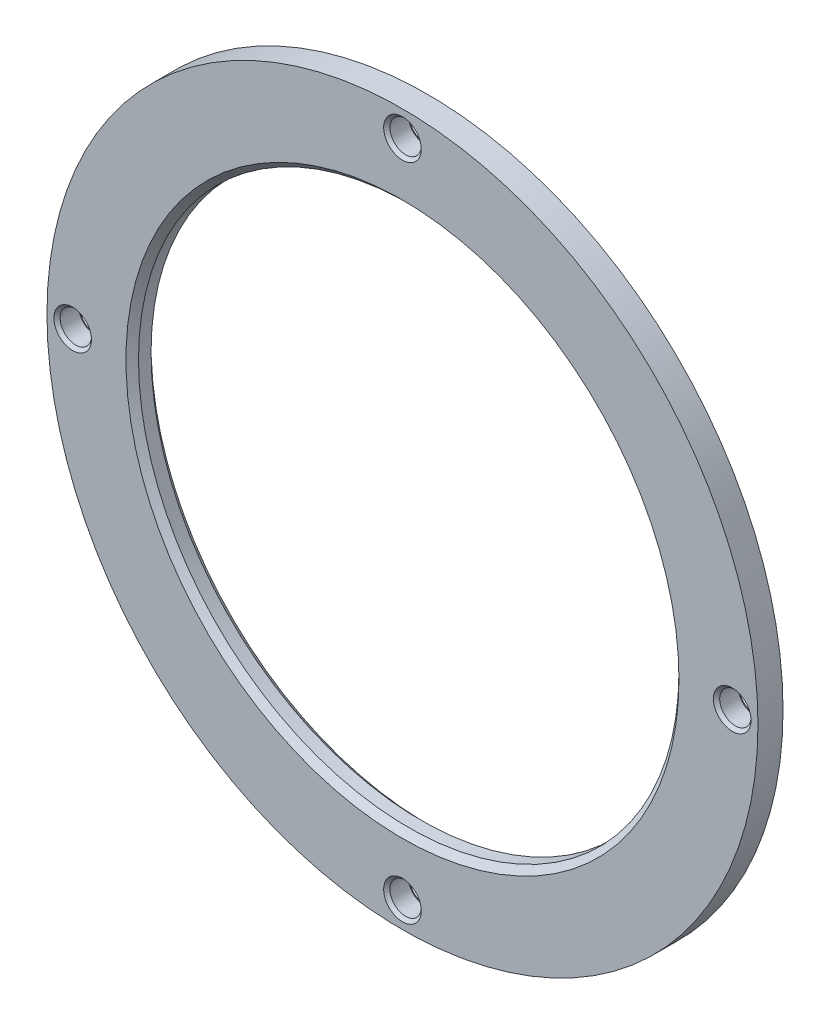
from build123d import *

# Parameters (mm, degrees)
SKETCH1_R           = 28.35
SKETCH1_R_2         = 21.55
EXTRUDE_THIN1_DEPTH = 2
CHAMFER1_SIZE       = 0.5
SKETCH2_R           = 1.25
CUT_EXTRUDE1_DEPTH  = 41.142807575
CIRPATTERN1_COUNT   = 4
CHAMFER2_SIZE       = 0.25


with BuildPart() as part:
    # Sketch1 → Extrude-Thin1 (new body)
    with BuildSketch(Plane(origin=(0, 0, 0), x_dir=(0, 1, 0), z_dir=(0, 0, 1))):
        Circle(SKETCH1_R)
        Circle(SKETCH1_R_2, mode=Mode.SUBTRACT)
    extrude(amount=EXTRUDE_THIN1_DEPTH)

    # Chamfer1
    chamfer1_edges = [part.edges().sort_by_distance(p)[0] for p in [
        (0, -21.55, 0),
        (0, -21.55, 2),
    ]]
    chamfer(chamfer1_edges, length=CHAMFER1_SIZE)

    # Sketch2 → Cut-Extrude1 (cut, through all)
    with BuildSketch(Plane(origin=(0, 0, 0), x_dir=(0, 1, 0), z_dir=(0, 0, 1))):
        with Locations(Location((0, 26.3, 0), (0, 0, 270))):
            Circle(SKETCH2_R)
    cut_extrude1 = extrude(amount=CUT_EXTRUDE1_DEPTH, mode=Mode.SUBTRACT)

    # CirPattern1: Cut-Extrude1 ×4 about axis
    cirpattern1_axis = Axis((0, 0, 0), (0, 0, 1))
    for i in range(1, CIRPATTERN1_COUNT):
        add(cut_extrude1.rotate(cirpattern1_axis, i * 360 / CIRPATTERN1_COUNT), mode=Mode.SUBTRACT)

    # Chamfer2
    chamfer2_edges = [part.edges().sort_by_distance(p)[0] for p in [
        (-27.55, 0, 0),
        (-27.55, 0, 2),
        (0, 27.55, 0),
        (0, 27.55, 2),
        (27.55, 0, 0),
        (27.55, 0, 2),
        (0, -27.55, 0),
        (0, -27.55, 2),
    ]]
    chamfer(chamfer2_edges, length=CHAMFER2_SIZE)


solid = part.part
